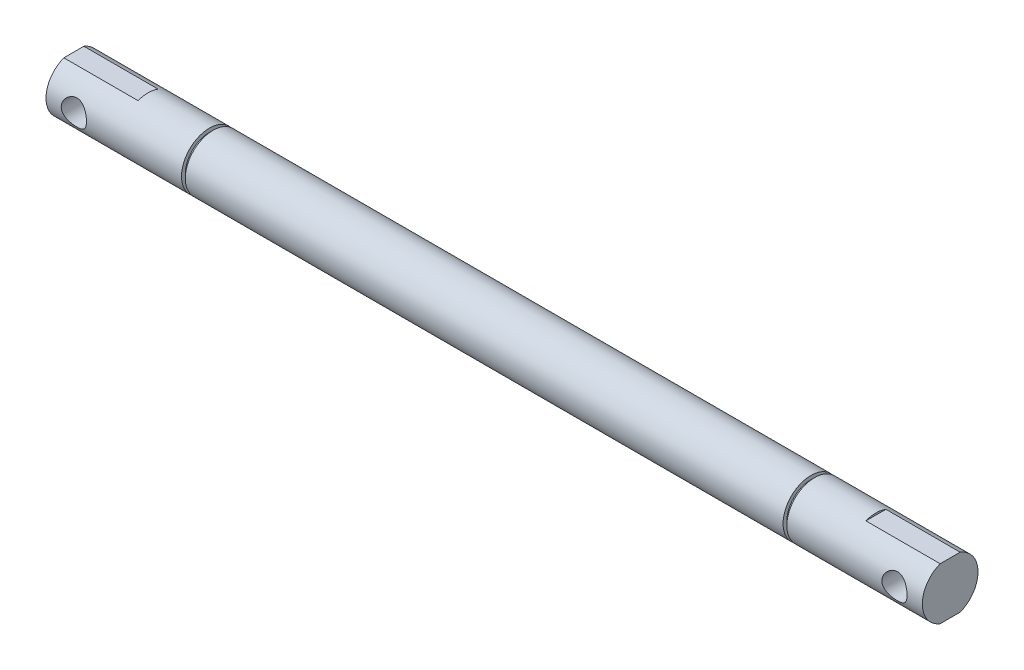
from build123d import *

# Parameters (mm, degrees)
SKETCH1_R                   = 7.5
BOSS_EXTRUDE1_DEPTH         = 118
SKETCH2_W                   = 1
SKETCH2_H                   = 2
CUT_EXTRUDE1_DEPTH          = 20
M8_TAPPED_HOLE1_D           = 6.8
M8_TAPPED_HOLE1_CSINK_D     = 8.05
M8_TAPPED_HOLE1_CSINK_ANGLE = 90
MIRROR4_COPY_1_DEPTH        = 20


with BuildPart() as part:
    # Sketch1 → Boss-Extrude1 (new, symmetric)
    with BuildSketch(Plane(origin=(0, 0, 0), x_dir=(0, 0, -1), z_dir=(1, 0, 0))):
        Circle(SKETCH1_R)
    extrude(amount=BOSS_EXTRUDE1_DEPTH, both=True)

    # Sketch2 → Cut-Revolve1 (revolve, cut)
    with BuildSketch(Plane.XY, mode=Mode.PRIVATE) as cut_revolve1_sk:
        with Locations((-81, 7.5)):
            Rectangle(SKETCH2_W, SKETCH2_H)
    cut_revolve1 = revolve(cut_revolve1_sk.sketch.rotate(Axis((0, 0, 0), (-1, 0, 0)), 90), axis=Axis((0, 0, 0), (-1, 0, 0)), mode=Mode.SUBTRACT)

    # Sketch3 → Cut-Extrude1 (cut)
    with BuildSketch(Plane.ZY.offset(118)):
        Polygon((-6.257056538, 7), (6.257056538, 7), (0.053674869, 13.20338167), align=None)
    cut_extrude1 = extrude(amount=-CUT_EXTRUDE1_DEPTH, mode=Mode.SUBTRACT)

    # Mirror2: Cut-Extrude1 across plane
    add(cut_extrude1.mirror(Plane.ZX), mode=Mode.SUBTRACT)

    # M8 Tapped Hole1 (through all)
    with Locations(Plane.XY.offset(17.221376604)):
        with Locations((-110.5, 0)):
            m8_tapped_hole1 = CounterSinkHole(M8_TAPPED_HOLE1_D / 2, M8_TAPPED_HOLE1_CSINK_D / 2, counter_sink_angle=M8_TAPPED_HOLE1_CSINK_ANGLE)

    # Mirror4: Cut-Revolve1, Cut-Extrude1, M8 Tapped Hole1 across plane
    add(cut_revolve1.mirror(Plane(origin=(0, 0, 0), x_dir=(0, 0, 1), z_dir=(1, 0, 0))), mode=Mode.SUBTRACT)
    add(cut_extrude1.mirror(Plane(origin=(0, 0, 0), x_dir=(0, 0, 1), z_dir=(1, 0, 0))), mode=Mode.SUBTRACT)
    add(m8_tapped_hole1.mirror(Plane(origin=(0, 0, 0), x_dir=(0, 0, 1), z_dir=(1, 0, 0))), mode=Mode.SUBTRACT)

    # Mirror4 copy 1 sketch → Mirror4 copy 1 (cut)
    with BuildSketch(Plane(origin=(118, 0, 0), x_dir=(0, 0, 1), z_dir=(1, 0, 0))):
        Polygon((-6.257056538, 7), (6.257056538, 7), (0.053674869, 13.20338167), align=None)
    extrude(amount=-MIRROR4_COPY_1_DEPTH, mode=Mode.SUBTRACT)


solid = part.part
